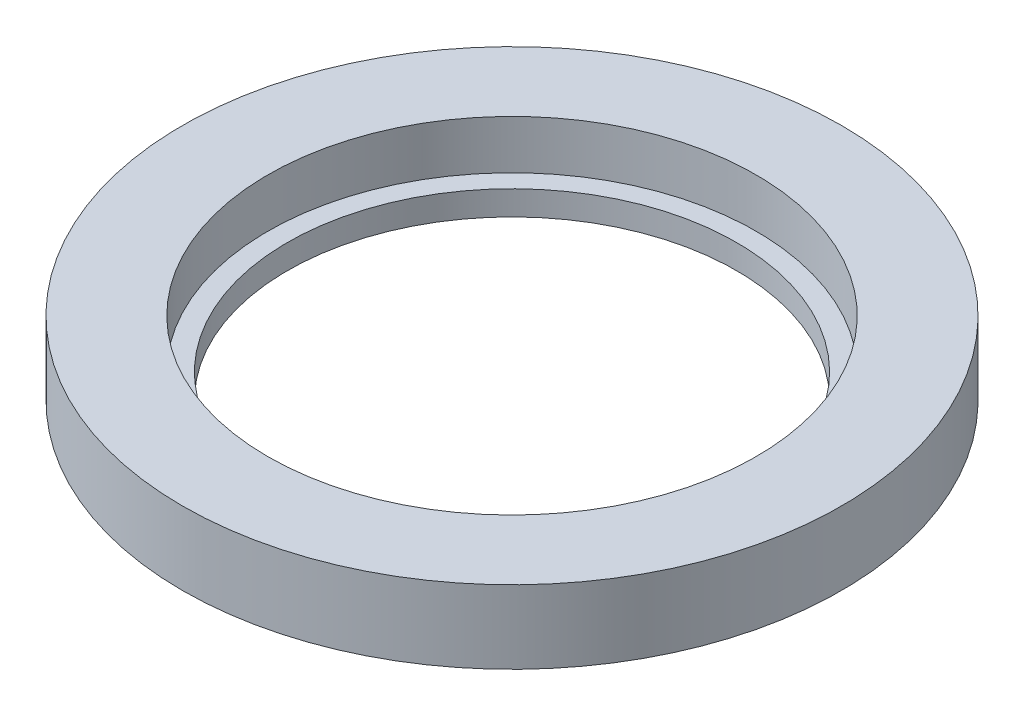
from build123d import *

# Parameters (mm, degrees)
SKETCH1_R           = 33.75
BOSS_EXTRUDE1_DEPTH = 7.5
SKETCH2_R           = 2.6
CUT_EXTRUDE1_DEPTH  = 2.5
SKETCH3_R           = 23
CUT_EXTRUDE2_DEPTH  = 49.315370225
SKETCH4_R           = 25
CUT_EXTRUDE3_DEPTH  = 5


with BuildPart() as part:
    # Sketch1 → Boss-Extrude1 (new body)
    with BuildSketch(Plane(origin=(0, 0, 0), x_dir=(1, 0, 0), z_dir=(0, 1, 0))):
        with Locations(Location((0, 0, 0), (0, 0, 270))):
            Circle(SKETCH1_R)
    extrude(amount=BOSS_EXTRUDE1_DEPTH)

    # Sketch2 → Cut-Extrude1 (cut)
    with BuildSketch(Plane.XZ):
        with Locations(Location((-30, 0, 0), (0, 0, 270))):
            Circle(SKETCH2_R)
        with Locations(Location((30, 0, 0), (0, 0, 90))):
            Circle(SKETCH2_R)
        with Locations(Location((0, -30, 0), (0, 0, 90))):
            Circle(SKETCH2_R)
        with Locations(Location((0, 30, 0), (0, 0, 270))):
            Circle(SKETCH2_R)
    extrude(amount=-CUT_EXTRUDE1_DEPTH, mode=Mode.SUBTRACT)

    # Sketch3 → Cut-Extrude2 (cut, through all)
    with BuildSketch(Plane(origin=(0, 7.5, 0), x_dir=(1, 0, 0), z_dir=(0, 1, 0))):
        with Locations(Location((0, 0, 0), (0, 0, 270))):
            Circle(SKETCH3_R)
    extrude(amount=-CUT_EXTRUDE2_DEPTH, mode=Mode.SUBTRACT)

    # Sketch4 → Cut-Extrude3 (cut)
    with BuildSketch(Plane(origin=(0, 7.5, 0), x_dir=(1, 0, 0), z_dir=(0, 1, 0))):
        with Locations(Location((0, 0, 0), (0, 0, 270))):
            Circle(SKETCH4_R)
    extrude(amount=-CUT_EXTRUDE3_DEPTH, mode=Mode.SUBTRACT)


solid = part.part
